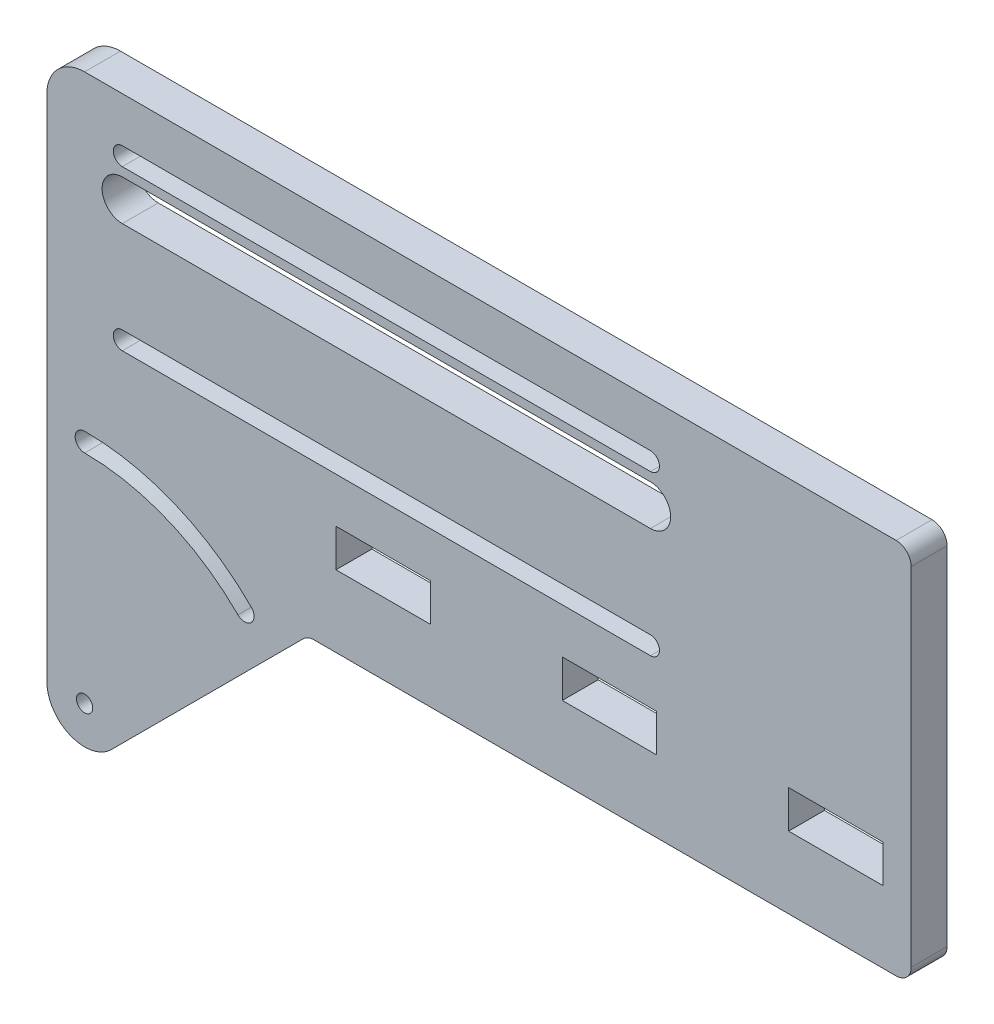
from build123d import *

# Parameters (mm, degrees)
SKETCH1_R           = 1.3716
BOSS_EXTRUDE1_DEPTH = 6.0452
SKETCH2_W           = 15.875
SKETCH2_H           = 6.35
CUT_EXTRUDE1_DEPTH  = 6.0452
CUT_EXTRUDE2_DEPTH  = 7.62


with BuildPart() as part:
    # Sketch1 → Boss-Extrude1 (new body)
    with BuildSketch(Plane.XY):
        with BuildLine():
            Line((-6.35, 85.725), (-6.35, 0))
            ThreePointArc((-6.35, 0), (-2.430039796, -5.866635031), (4.490128061, -4.490128061))
            Line((4.490128061, -4.490128061), (31.430896424, 22.450640303))
            Line((31.430896424, 22.450640303), (36.811307345, 27.831051224))
            ThreePointArc((36.811307345, 27.831051224), (37.635342651, 28.381654013), (38.607358569, 28.575))
            Line((38.607358569, 28.575), (136.615256121, 28.575))
            ThreePointArc((136.615256121, 28.575), (138.411307345, 29.318948776), (139.155256121, 31.115))
            Line((139.155256121, 31.115), (139.155256121, 89.535))
            ThreePointArc((139.155256121, 89.535), (138.411307345, 91.331051224), (136.615256121, 92.075))
            Line((136.615256121, 92.075), (0, 92.075))
            ThreePointArc((0, 92.075), (-4.490128061, 90.215128061), (-6.35, 85.725))
        make_face()
        Circle(SKETCH1_R, mode=Mode.SUBTRACT)
        with BuildLine():
            ThreePointArc((25.818236348, 25.818236348), (13.972728824, 33.733151431), (0, 36.5125))
            ThreePointArc((0, 36.5125), (-1.5875, 38.1), (0, 39.6875))
            ThreePointArc((0, 39.6875), (15.187748722, 36.666468947), (28.063300378, 28.063300378))
            ThreePointArc((28.063300378, 28.063300378), (28.063300378, 25.818236348), (25.818236348, 25.818236348))
        make_face(mode=Mode.SUBTRACT)
    extrude(amount=BOSS_EXTRUDE1_DEPTH)

    # Sketch2 → Cut-Extrude1 (cut)
    with BuildSketch(Plane.XY.offset(6.0452)):
        with Locations((126.455256121, 43.815)):
            Rectangle(SKETCH2_W, SKETCH2_H)
        with Locations((88.355256121, 43.815)):
            Rectangle(SKETCH2_W, SKETCH2_H)
        with Locations((50.255256121, 43.815)):
            Rectangle(SKETCH2_W, SKETCH2_H)
    extrude(amount=-CUT_EXTRUDE1_DEPTH, mode=Mode.SUBTRACT)

    # Sketch3 → Cut-Extrude2 (cut)
    with BuildSketch(Plane(origin=(0, 0, 0), x_dir=(-1, 0, 0), z_dir=(0, 0, -1))):
        with BuildLine():
            Line((-95.25, 84.4804), (-6.35, 84.4804))
            ThreePointArc((-6.35, 84.4804), (-4.826, 82.9564), (-6.35, 81.4324))
            Line((-6.35, 81.4324), (-95.25, 81.4324))
            ThreePointArc((-95.25, 81.4324), (-96.774, 82.9564), (-95.25, 84.4804))
        make_face()
        with BuildLine():
            Line((-95.25, 57.6326), (-6.35, 57.6326))
            ThreePointArc((-6.35, 57.6326), (-4.826, 56.1086), (-6.35, 54.5846))
            Line((-6.35, 54.5846), (-95.25, 54.5846))
            ThreePointArc((-95.25, 54.5846), (-96.774, 56.1086), (-95.25, 57.6326))
        make_face()
        with BuildLine():
            Line((-95.25, 73.1266), (-6.35, 73.1266))
            ThreePointArc((-6.35, 73.1266), (-2.9464, 76.5302), (-6.35, 79.9338))
            Line((-6.35, 79.9338), (-95.25, 79.9338))
            ThreePointArc((-95.25, 79.9338), (-98.6536, 76.5302), (-95.25, 73.1266))
        make_face()
    extrude(amount=-CUT_EXTRUDE2_DEPTH, mode=Mode.SUBTRACT)


solid = part.part
